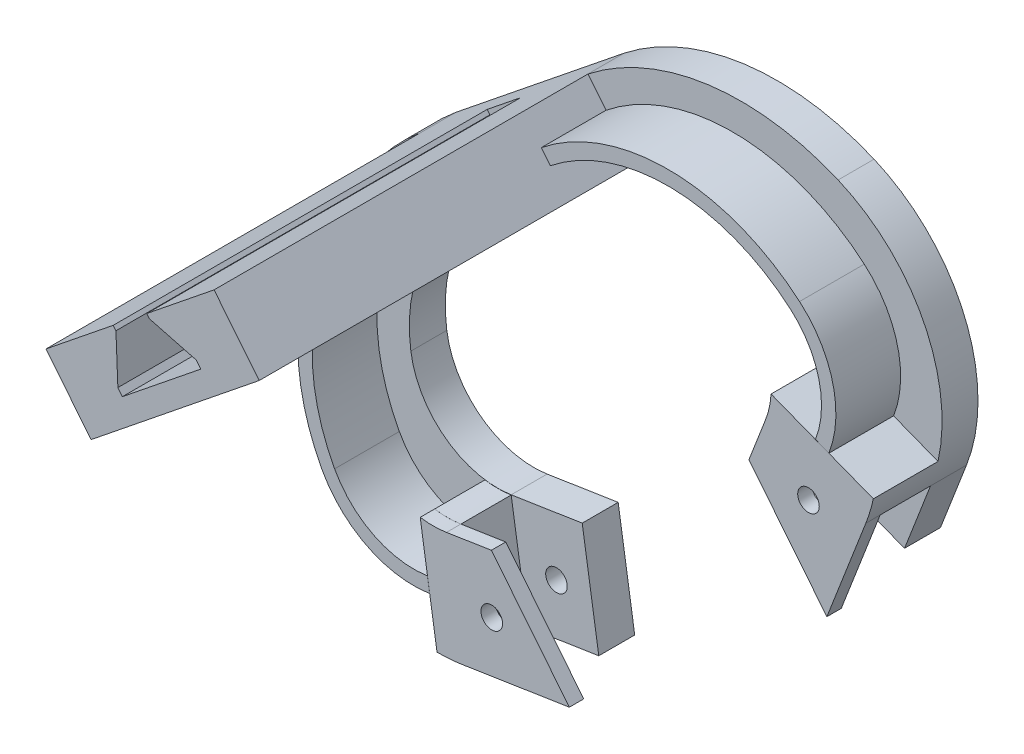
from build123d import *

# Parameters (mm, degrees)
ESTRUSIONE_ESTRUSIONE1_DEPTH = 5
ESTRUSIONE_ESTRUSIONE2_DEPTH = 7
ESTRUSIONE_ESTRUSIONE3_DEPTH = 2
ESTRUSIONE_ESTRUSIONE4_DEPTH = 52
TAGLIO_ESTRUSIONE2_DEPTH     = 52
ESTRUSIONE_ESTRUSIONE5_DEPTH = 9
FORI_FILETTATI_3_0MM1_D      = 3


with BuildPart() as part:
    # Schizzo1 → Estrusione-Estrusione1 (new body)
    with BuildSketch(Plane.XY):
        with BuildLine():
            Line((-82.995904107, -166.584374689), (-92.877799089, -168.116742646))
            ThreePointArc((-92.877799089, -168.116742646), (-110.220012955, -164.040092202), (-119.840608042, -149.046239769))
            ThreePointArc((-119.840608042, -149.046239769), (-118.364815633, -130.917411526), (-107.867932944, -116.063192243))
            Line((-107.867932944, -116.063192243), (-84.49215827, -97.259651129))
            ThreePointArc((-84.49215827, -97.259651129), (-67.733683115, -90.189581316), (-49.709718148, -92.632748029))
            ThreePointArc((-49.709718148, -92.632748029), (-37.125664022, -105.242785395), (-36.859828578, -123.055724291))
            Line((-36.859828578, -123.055724291), (-40.474113425, -132.379722631))
            Line((-40.474113425, -132.379722631), (-54.467826156, -126.955304689))
            Line((-54.467826156, -126.955304689), (-50.853541308, -117.631306349))
            ThreePointArc((-50.853541308, -117.631306349), (-51.095893898, -108.22813541), (-57.953355129, -101.789689638))
            ThreePointArc((-57.953355129, -101.789689638), (-68.520842721, -100.735914417), (-78.224311232, -105.051576021))
            Line((-78.224311232, -105.051576021), (-101.600085906, -123.855117134))
            ThreePointArc((-101.600085906, -123.855117134), (-107.894780127, -132.408424149), (-109.129903142, -142.956253658))
            ThreePointArc((-109.129903142, -142.956253658), (-104.310440062, -151.034071069), (-95.177618995, -153.285723315))
            Line((-95.177618995, -153.285723315), (-85.295724012, -151.753355358))
            Line((-85.295724012, -151.753355358), (-82.995904107, -166.584374689))
        make_face()
    extrude(amount=ESTRUSIONE_ESTRUSIONE1_DEPTH)

    # Schizzo2 → Estrusione-Estrusione2 (add)
    with BuildSketch(Plane.XY.offset(5)):
        with BuildLine():
            Line((-36.859828578, -123.055724291), (-50.830842779, -117.640105037))
            ThreePointArc((-50.830842779, -117.640105037), (-50.298673229, -115.886666013), (-50.034997321, -114.073318872))
            Line((-50.034997321, -114.073318872), (-35.811832194, -119.586680021))
            ThreePointArc((-35.811832194, -119.586680021), (-36.269524014, -121.341233275), (-36.859828578, -123.055724291))
        make_face()
        with BuildLine():
            Line((-96.490830562, -168.397042736), (-98.828360202, -153.322841843))
            ThreePointArc((-98.828360202, -153.322841843), (-97.000632762, -153.453858051), (-95.173888567, -153.309779998))
            Line((-95.173888567, -153.309779998), (-92.877799089, -168.116742646))
            ThreePointArc((-92.877799089, -168.116742646), (-94.678957246, -168.325951195), (-96.490830562, -168.397042736))
        make_face()
    extrude(amount=ESTRUSIONE_ESTRUSIONE2_DEPTH)

    # Schizzo3 → Estrusione-Estrusione3 (add)
    with BuildSketch(Plane.XY.offset(12)):
        with BuildLine():
            Line((-42.270578454, -137.014176653), (-36.859828578, -123.055724291))
            ThreePointArc((-36.859828578, -123.055724291), (-36.269524014, -121.341233275), (-35.811832194, -119.586680021))
            Line((-35.811832194, -119.586680021), (-50.034997321, -114.073318872))
            ThreePointArc((-50.034997321, -114.073318872), (-50.288758238, -115.888878313), (-50.830842779, -117.640105037))
            Line((-50.830842779, -117.640105037), (-53.115040991, -123.532795079))
            Line((-53.115040991, -123.532795079), (-42.270578454, -137.014176653))
        make_face()
        with BuildLine():
            Line((-96.490830562, -168.397042736), (-98.828360202, -153.322841843))
            ThreePointArc((-98.828360202, -153.322841843), (-97.000596453, -153.464016791), (-95.173888567, -153.309779998))
            Line((-95.173888567, -153.309779998), (-88.928612449, -152.34133609))
            Line((-88.928612449, -152.34133609), (-78.084149913, -165.822717664))
            Line((-78.084149913, -165.822717664), (-92.877799089, -168.116742646))
            ThreePointArc((-92.877799089, -168.116742646), (-94.678957246, -168.325951195), (-96.490830562, -168.397042736))
        make_face()
    extrude(amount=ESTRUSIONE_ESTRUSIONE3_DEPTH)

    # Schizzo4 → Estrusione-Estrusione4 (add)
    with BuildSketch(Plane.XY.offset(5)):
        Polygon((-101.600085906, -123.855117134), (-78.224311232, -105.051576021), (-84.49215827, -97.259651129), (-107.867932944, -116.063192243), align=None)
    extrude(amount=ESTRUSIONE_ESTRUSIONE4_DEPTH)

    # Schizzo5 → Taglio-Estrusione2 (cut)
    with BuildSketch(Plane.XY.offset(57)):
        Polygon((-97.246900104, -116.503262037), (-97.873684808, -115.724069548), (-98.141552252, -109.009291291), (-98.517623074, -108.541775798), (-93.842468139, -104.781067575), (-93.466397317, -105.248583068), (-86.96498996, -106.949083694), (-86.338205256, -107.728276184), align=None)
    extrude(amount=-TAGLIO_ESTRUSIONE2_DEPTH, mode=Mode.SUBTRACT)

    # Schizzo6 → Estrusione-Estrusione5 (add)
    with BuildSketch(Plane.XY.offset(5)):
        with BuildLine():
            Line((-105.360794128, -119.1799622), (-104.107224721, -120.738347178))
            ThreePointArc((-104.107224721, -120.738347178), (-113.327097811, -135.89060806), (-110.731703589, -153.436576214))
            ThreePointArc((-110.731703589, -153.436576214), (-105.298812913, -158.702833766), (-97.823256998, -159.87152255))
            Line((-97.823256998, -159.87152255), (-97.519846298, -161.848374074))
            ThreePointArc((-97.519846298, -161.848374074), (-106.191101066, -160.49275607), (-112.492970749, -154.384172115))
            ThreePointArc((-112.492970749, -154.384172115), (-115.28727508, -135.493487076), (-105.360794128, -119.1799622))
        make_face()
        with BuildLine():
            Line((-43.853805634, -116.458338954), (-41.987888093, -117.178305432))
            ThreePointArc((-41.987888093, -117.178305432), (-41.453924934, -108.417983362), (-46.070241465, -100.953535552))
            ThreePointArc((-46.070241465, -100.953535552), (-63.923362402, -94.176206375), (-81.985019455, -100.376421086))
            Line((-81.985019455, -100.376421086), (-80.731450047, -101.934806064))
            ThreePointArc((-80.731450047, -101.934806064), (-63.955496248, -96.175948212), (-47.373234104, -102.470839142))
            ThreePointArc((-47.373234104, -102.470839142), (-43.393471858, -108.905997429), (-43.853805634, -116.458338954))
        make_face()
    extrude(amount=ESTRUSIONE_ESTRUSIONE5_DEPTH)

    # Fori filettati Ø3.0mm1 (through all)
    with Locations(Plane.XY.offset(14)):
        with Locations((-88.877799089, -160.412808131), (-44.832341355, -124.255324234)):
            Hole(FORI_FILETTATI_3_0MM1_D / 2)


solid = part.part
